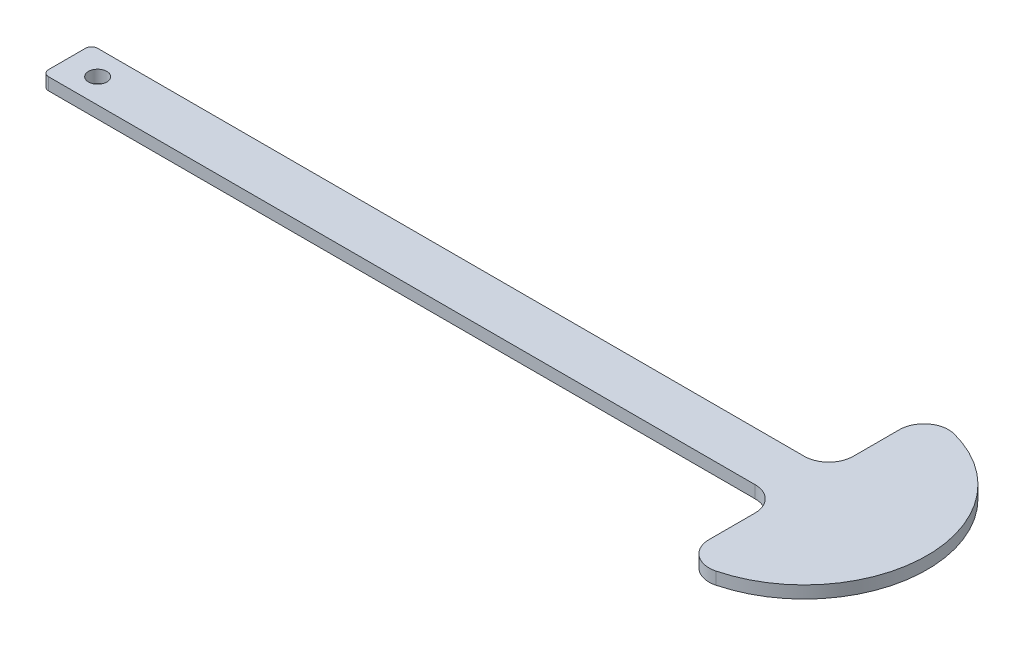
from build123d import *

# Parameters (mm, degrees)
SKETCH1_R           = 1.5
BOSS_EXTRUDE1_DEPTH = 2


with BuildPart() as part:
    # Sketch1 → Boss-Extrude1 (new body)
    with BuildSketch(Plane(origin=(0, 0, 0), x_dir=(1, 0, 0), z_dir=(0, 1, 0))):
        with BuildLine():
            Line((60, 15.491933385), (60, 8))
            ThreePointArc((60, 8), (58.828427125, 5.171572875), (56, 4))
            Line((56, 4), (-59, 4))
            ThreePointArc((-59, 4), (-59.707106781, 3.707106781), (-60, 3))
            Line((-60, 3), (-60, -3))
            ThreePointArc((-60, -3), (-59.707106781, -3.707106781), (-59, -4))
            Line((-59, -4), (56, -4))
            ThreePointArc((56, -4), (58.828427125, -5.171572875), (60, -8))
            Line((60, -8), (60, -15.491933385))
            ThreePointArc((60, -15.491933385), (61.550510257, -18.654211045), (65, -19.364916731))
            ThreePointArc((65, -19.364916731), (80, 0), (65, 19.364916731))
            ThreePointArc((65, 19.364916731), (61.550510257, 18.654211045), (60, 15.491933385))
        make_face()
        with Locations(Location((-55, 0, 0), (0, 0, 270))):
            Circle(SKETCH1_R, mode=Mode.SUBTRACT)
    extrude(amount=BOSS_EXTRUDE1_DEPTH)


solid = part.part
